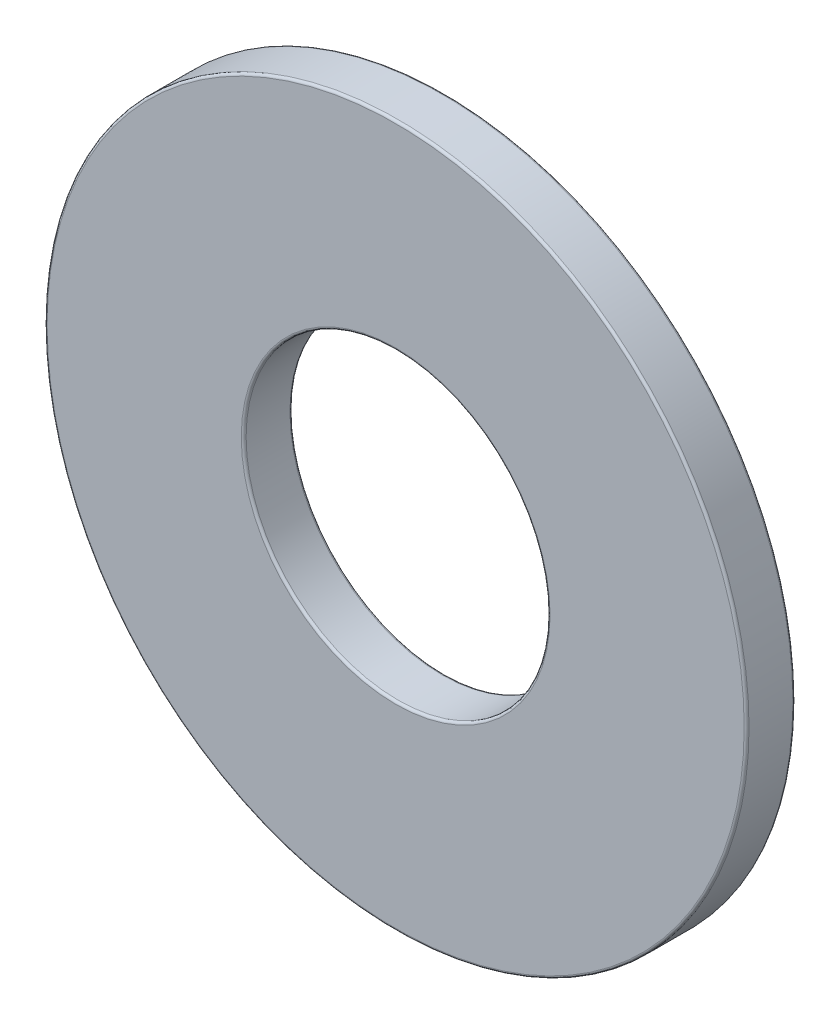
from build123d import *

# Parameters (mm, degrees)
SKETCH3_R           = 23.8125
SKETCH3_R_2         = 10.3124
BOSS_EXTRUDE1_DEPTH = 1.651
FILLET1_R           = 0.1651


with BuildPart() as part:
    # Sketch3 → Boss-Extrude1 (new, symmetric)
    with BuildSketch(Plane.XY):
        with Locations(Location((0, 0, 0), (0, 0, 180))):
            Circle(SKETCH3_R)
        with Locations(Location((0, 0, 0), (0, 0, 180))):
            Circle(SKETCH3_R_2, mode=Mode.SUBTRACT)
    extrude(amount=BOSS_EXTRUDE1_DEPTH, both=True)

    # Fillet1
    fillet1_edges = [part.edges().sort_by_distance(p)[0] for p in [
        (23.8125, 0, -1.651),
        (23.8125, 0, 1.651),
        (10.3124, 0, -1.651),
        (10.3124, 0, 1.651),
    ]]
    fillet(fillet1_edges, radius=FILLET1_R)


solid = part.part
